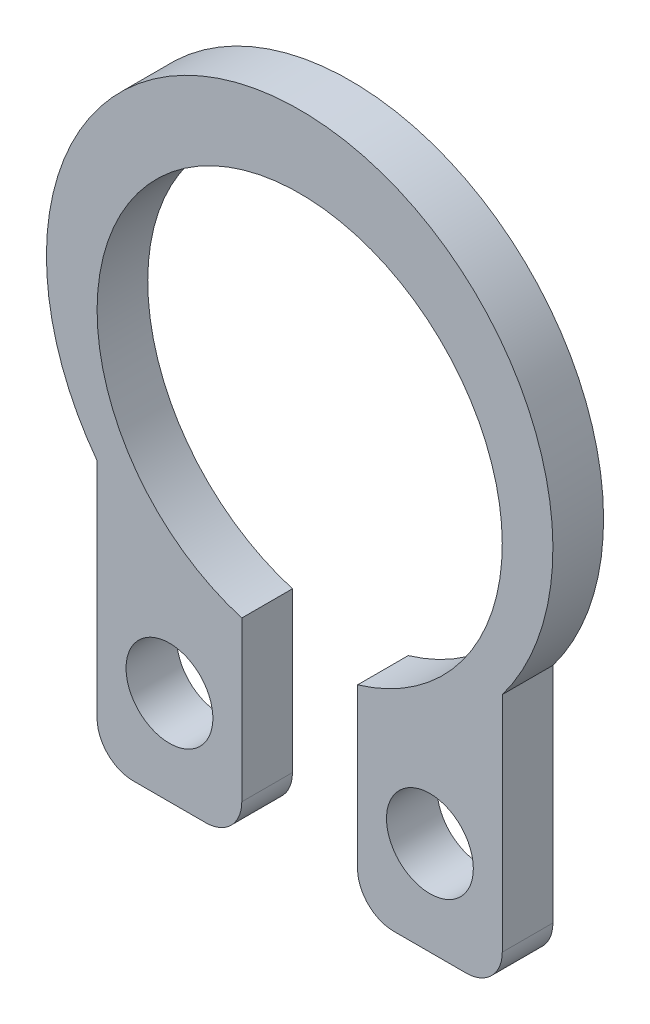
from build123d import *

# Parameters (mm, degrees)
SZKIC1_R                    = 0.6
DODANIE_WYCI_GNI_CIE1_DEPTH = 0.7


with BuildPart() as part:
    # Szkic1 → Dodanie-wyciągnięcie1 (new body)
    with BuildSketch(Plane.XY):
        with BuildLine():
            Line((0.8, -2.683281573), (0.8, -4.883281573))
            ThreePointArc((0.8, -4.883281573), (0.946446609, -5.236834964), (1.3, -5.383281573))
            Line((1.3, -5.383281573), (2.3, -5.383281573))
            ThreePointArc((2.3, -5.383281573), (2.653553391, -5.236834964), (2.8, -4.883281573))
            Line((2.8, -4.883281573), (2.8, -1.8))
            ThreePointArc((2.8, -1.8), (0, 3.8), (-2.8, -1.8))
            Line((-2.8, -1.8), (-2.8, -4.883281573))
            ThreePointArc((-2.8, -4.883281573), (-2.653553391, -5.236834964), (-2.3, -5.383281573))
            Line((-2.3, -5.383281573), (-1.3, -5.383281573))
            ThreePointArc((-1.3, -5.383281573), (-0.946446609, -5.236834964), (-0.8, -4.883281573))
            Line((-0.8, -4.883281573), (-0.8, -2.683281573))
            ThreePointArc((-0.8, -2.683281573), (0, 2.8), (0.8, -2.683281573))
        make_face()
        with Locations((1.8, -4.083281573)):
            Circle(SZKIC1_R, mode=Mode.SUBTRACT)
        with Locations(Location((-1.8, -4.083281573, 0), (0, 0, 180))):
            Circle(SZKIC1_R, mode=Mode.SUBTRACT)
    extrude(amount=DODANIE_WYCI_GNI_CIE1_DEPTH)


solid = part.part
